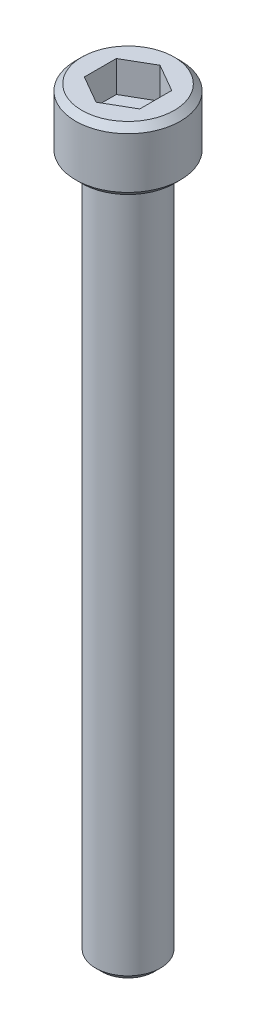
from build123d import *

# Parameters (mm, degrees)
SKETCH1_W           = 3.3655
SKETCH1_H           = 4.064
SKETCH2_R           = 2.0828
BOSS_EXTRUDE1_DEPTH = 44.45
CUT_EXTRUDE1_DEPTH  = 2
CHAMFER1_SIZE       = 0.4


with BuildPart() as part:
    # Sketch1 → Revolve1 (revolve)
    with BuildSketch(Plane.XY, mode=Mode.PRIVATE) as revolve1_sk:
        with Locations((1.68275, 2.032)):
            Rectangle(SKETCH1_W, SKETCH1_H)
    revolve(revolve1_sk.sketch.rotate(Axis((0, 4.064, 0), (0, -1, 0)), 270), axis=Axis((0, 4.064, 0), (0, -1, 0)))

    # Sketch2 → Boss-Extrude1 (add)
    with BuildSketch(Plane.XZ):
        with Locations(Location((0, 0, 0), (0, 0, 270))):
            Circle(SKETCH2_R)
    extrude(amount=BOSS_EXTRUDE1_DEPTH)

    # Sketch3 → Cut-Extrude1 (cut)
    with BuildSketch(Plane(origin=(0, 4.064, 0), x_dir=(-1, 0, 0), z_dir=(0, 1, 0))):
        Polygon((-1.778, -1.026528779), (0, -2.053057557), (1.778, -1.026528779), (1.778, 1.026528779), (0, 2.053057557), (-1.778, 1.026528779), align=None)
    extrude(amount=-CUT_EXTRUDE1_DEPTH, mode=Mode.SUBTRACT)

    # Chamfer1
    chamfer1_edges = [part.edges().sort_by_distance(p)[0] for p in [
        (0, 0, 3.3655),
        (0, 4.064, 3.3655),
        (0, -44.45, 2.0828),
    ]]
    chamfer(chamfer1_edges, length=CHAMFER1_SIZE)


solid = part.part
